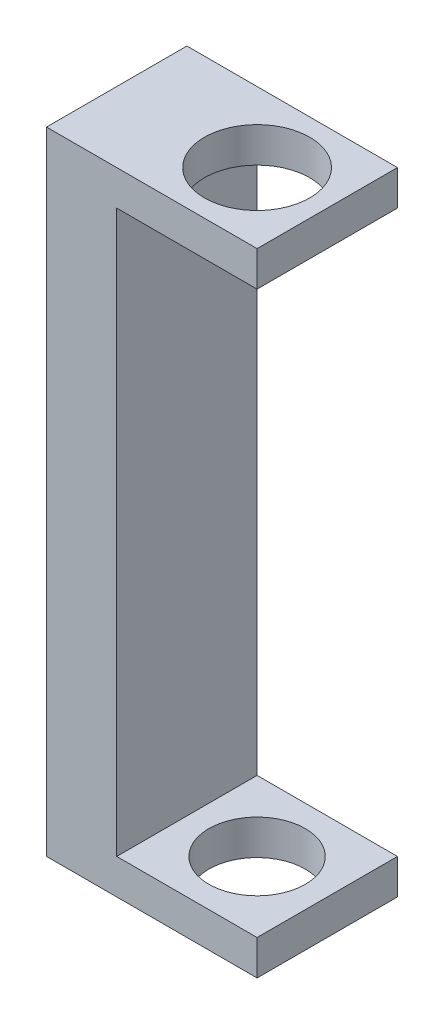
from build123d import *

# Parameters (mm, degrees)
SKETCH1_W                  = 76.2
SKETCH1_H                  = 50.8
BOSS_EXTRUDE1_DEPTH        = 228.6
SKETCH2_W                  = 50.8
SKETCH2_H                  = 203.2
CUT_EXTRUDE1_DEPTH         = 247.262136757
CUT_EXTRUDE2_REACH         = 248.262
SKETCH5_R                  = 19.05
CUT_EXTRUDE3_REACH         = 248.262
SKETCH8_R                  = 17.4625
F_10_32_TAPPED_HOLE1_D     = 4.0386
F_10_32_TAPPED_HOLE1_DEPTH = 42.0624
F_10_32_TAPPED_HOLE1_TIP   = 1.213317848


with BuildPart() as part:
    # Sketch1 → Boss-Extrude1 (new body)
    with BuildSketch(Plane(origin=(0, 0, 0), x_dir=(1, 0, 0), z_dir=(0, 1, 0))):
        with Locations((38.1, 25.4)):
            Rectangle(SKETCH1_W, SKETCH1_H)
    extrude(amount=BOSS_EXTRUDE1_DEPTH)

    # Sketch2 → Cut-Extrude1 (cut, through all)
    with BuildSketch(Plane.XY):
        with Locations((50.8, 114.3)):
            Rectangle(SKETCH2_W, SKETCH2_H)
    extrude(amount=-CUT_EXTRUDE1_DEPTH, mode=Mode.SUBTRACT)

    # Sketch5 → Cut-Extrude2 (cut, up to next)
    with BuildSketch(Plane(origin=(0, 228.6, 0), x_dir=(1, 0, 0), z_dir=(0, 1, 0)), mode=Mode.PRIVATE) as cut_extrude2_sk1:
        with Locations(Location((50.8, 25.4, 0), (0, 0, 270))):
            Circle(SKETCH5_R)
    cut_extrude2_tool1 = extrude(cut_extrude2_sk1.sketch, amount=-CUT_EXTRUDE2_REACH, mode=Mode.PRIVATE) & part.part
    add(cut_extrude2_tool1.solids().sort_by_distance((50.8, 228.6, -25.4))[0], mode=Mode.SUBTRACT)

    # Sketch8 → Cut-Extrude3 (cut, up to next)
    with BuildSketch(Plane.XZ, mode=Mode.PRIVATE) as cut_extrude3_sk1:
        with Locations(Location((50.8, -25.4, 0), (0, 0, 270))):
            Circle(SKETCH8_R)
    cut_extrude3_tool1 = extrude(cut_extrude3_sk1.sketch, amount=-CUT_EXTRUDE3_REACH, mode=Mode.PRIVATE) & part.part
    add(cut_extrude3_tool1.solids().sort_by_distance((50.8, 0, -25.4))[0], mode=Mode.SUBTRACT)

    # #10-32 Tapped Hole1
    with Locations(Plane(origin=(0, 0, 0), x_dir=(-1, 0, 0), z_dir=(0, -1, 0))):
        with Locations((-6.35, 44.45), (-19.05, 44.45), (-6.35, 6.35), (-19.05, 6.35)):
            Hole(F_10_32_TAPPED_HOLE1_D / 2, depth=F_10_32_TAPPED_HOLE1_DEPTH)
            with Locations((0, 0, -(F_10_32_TAPPED_HOLE1_DEPTH + F_10_32_TAPPED_HOLE1_TIP / 2))):  # 118° drill point
                Cone(0, F_10_32_TAPPED_HOLE1_D / 2, F_10_32_TAPPED_HOLE1_TIP, mode=Mode.SUBTRACT)


solid = part.part
